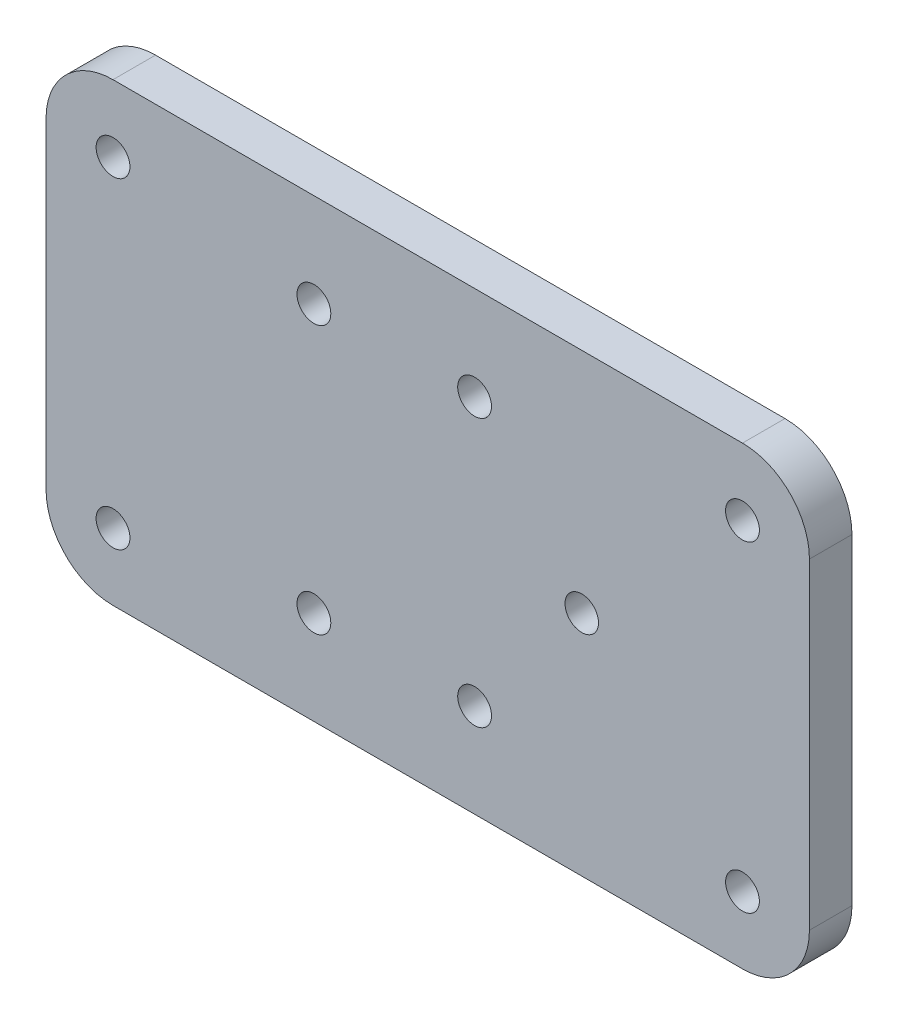
from build123d import *

# Parameters (mm, degrees)
SKETCH1_R           = 2.525
SKETCH1_R_2         = 2.5
BOSS_EXTRUDE1_DEPTH = 6.35
SKETCH2_W           = 54
SKETCH2_H           = 54
CUT_EXTRUDE1_DEPTH  = 2.3
CUT_EXTRUDE2_DEPTH  = 2.3


with BuildPart() as part:
    # Sketch1 → Boss-Extrude1 (new body)
    with BuildSketch(Plane.XY):
        with BuildLine():
            Line((-47, 34), (47, 34))
            ThreePointArc((47, 34), (54.071067812, 31.071067812), (57, 24))
            Line((57, 24), (57, -24))
            ThreePointArc((57, -24), (54.071067812, -31.071067812), (47, -34))
            Line((47, -34), (-47, -34))
            ThreePointArc((-47, -34), (-54.071067812, -31.071067812), (-57, -24))
            Line((-57, -24), (-57, 24))
            ThreePointArc((-57, 24), (-54.071067812, 31.071067812), (-47, 34))
        make_face()
        with Locations((-47, -24)):
            Circle(SKETCH1_R, mode=Mode.SUBTRACT)
        with Locations((47, -24)):
            Circle(SKETCH1_R, mode=Mode.SUBTRACT)
        with Locations((47, 24)):
            Circle(SKETCH1_R, mode=Mode.SUBTRACT)
        with Locations((-47, 24)):
            Circle(SKETCH1_R, mode=Mode.SUBTRACT)
        with Locations((-17, 20)):
            Circle(SKETCH1_R, mode=Mode.SUBTRACT)
        with Locations((-17, -20)):
            Circle(SKETCH1_R, mode=Mode.SUBTRACT)
        with Locations((7, 20)):
            Circle(SKETCH1_R, mode=Mode.SUBTRACT)
        with Locations((7, -20)):
            Circle(SKETCH1_R, mode=Mode.SUBTRACT)
        with Locations((23, 0)):
            Circle(SKETCH1_R_2, mode=Mode.SUBTRACT)
    extrude(amount=BOSS_EXTRUDE1_DEPTH)

    # Sketch2 → Cut-Extrude1 (cut)
    with BuildSketch(Plane(origin=(0, 0, 0), x_dir=(-1, 0, 0), z_dir=(0, 0, -1))):
        with Locations((-1, 0)):
            Rectangle(SKETCH2_W, SKETCH2_H)
    extrude(amount=-CUT_EXTRUDE1_DEPTH, mode=Mode.SUBTRACT)

    # Sketch3 → Cut-Extrude2 (cut)
    with BuildSketch(Plane(origin=(0, 0, 2.3), x_dir=(-1, 0, 0), z_dir=(0, 0, -1))):
        with BuildLine():
            Line((-22.483177153, 27), (-22.483177153, 21.483177153))
            Line((-22.483177153, 21.483177153), (-28, 21.483177153))
            ThreePointArc((-28, 21.483177153), (-28.127559597, 22.485277608), (-28.502102661, 23.423464298))
            ThreePointArc((-28.502102661, 23.423464298), (-28, 27), (-24.423464298, 27.502102661))
            ThreePointArc((-24.423464298, 27.502102661), (-23.485277608, 27.127559597), (-22.483177153, 27))
        make_face()
        with BuildLine():
            Line((20.483177153, 21.483177153), (26, 21.483177153))
            ThreePointArc((26, 21.483177153), (26.127559597, 22.485277608), (26.502102661, 23.423464298))
            ThreePointArc((26.502102661, 23.423464298), (26, 27), (22.423464298, 27.502102661))
            ThreePointArc((22.423464298, 27.502102661), (21.485277608, 27.127559597), (20.483177153, 27))
            Line((20.483177153, 27), (20.483177153, 21.483177153))
        make_face()
        with BuildLine():
            Line((20.483177153, -27), (20.483177153, -21.483177153))
            Line((20.483177153, -21.483177153), (26, -21.483177153))
            ThreePointArc((26, -21.483177153), (26.127559597, -22.485277608), (26.502102661, -23.423464298))
            ThreePointArc((26.502102661, -23.423464298), (26, -27), (22.423464298, -27.502102661))
            ThreePointArc((22.423464298, -27.502102661), (21.485277608, -27.127559597), (20.483177153, -27))
        make_face()
        with BuildLine():
            Line((-22.483177153, -21.483177153), (-28, -21.483177153))
            ThreePointArc((-28, -21.483177153), (-28.127559597, -22.485277608), (-28.502102661, -23.423464298))
            ThreePointArc((-28.502102661, -23.423464298), (-28, -27), (-24.423464298, -27.502102661))
            ThreePointArc((-24.423464298, -27.502102661), (-23.485277608, -27.127559597), (-22.483177153, -27))
            Line((-22.483177153, -27), (-22.483177153, -21.483177153))
        make_face()
    extrude(amount=CUT_EXTRUDE2_DEPTH, mode=Mode.SUBTRACT)


solid = part.part
